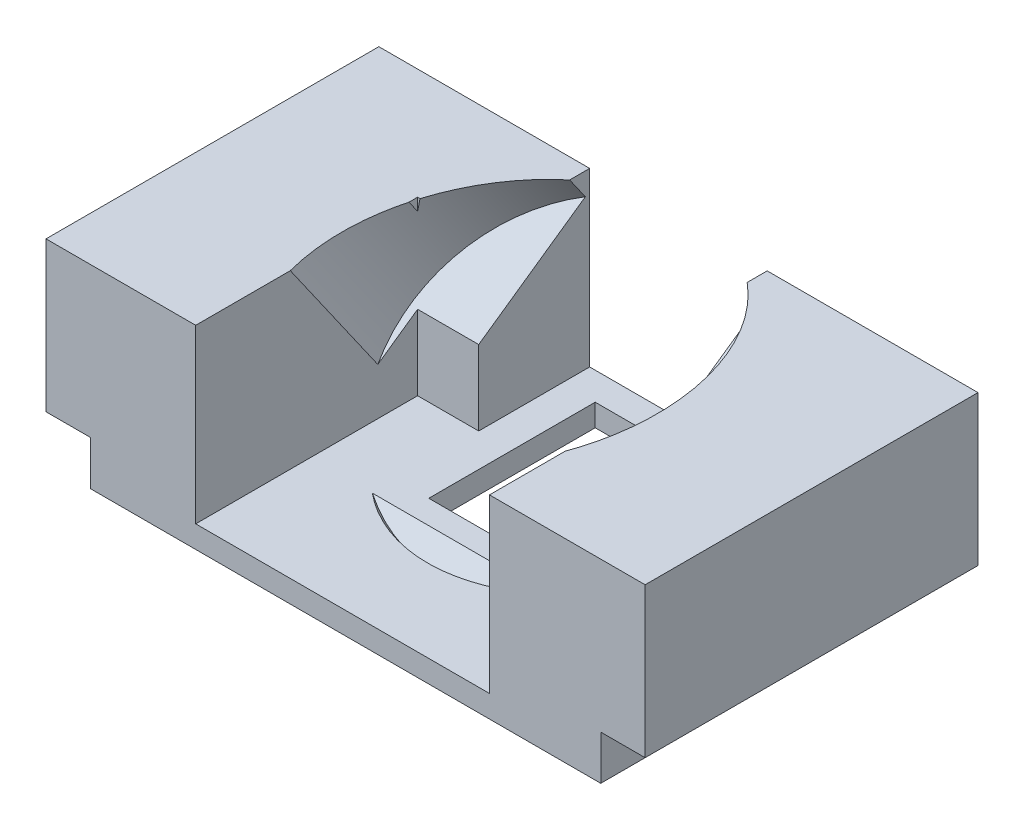
from build123d import *

# Parameters (mm, degrees)
SKETCH1_W               = 50.8
SKETCH1_H               = 22.225
BOSS_EXTRUDE1_DEPTH     = 34.29
SKETCH2_R               = 18.034
CUT_EXTRUDE1_DEPTH      = 45.095938092
SKETCH3_W               = 20.32
SKETCH3_H               = 19.685
CUT_EXTRUDE2_DEPTH      = 63.289098213
SKETCH4_W               = 12.7
SKETCH4_H               = 19.05
CUT_EXTRUDE3_DEPTH      = 45.095938092
SKETCH7_W               = 68.58
SKETCH7_H               = 12.7
CUT_EXTRUDE5_DEPTH      = 49.113560718
CUT_EXTRUDE6_DEPTH      = 45.095938092
CUT_EXTRUDE6_DEPTH_BACK = 45.095938092
SKETCH9_W               = 5.08
SKETCH9_H               = 5.08
SKETCH6_W               = 33.625329213
SKETCH6_H               = 19.685
CUT_EXTRUDE4_DEPTH      = 45.095938092


with BuildPart() as part:
    # Sketch1 → Boss-Extrude1 (new, symmetric)
    with BuildSketch(Plane(origin=(0, 0, 0), x_dir=(0, 0, -1), z_dir=(1, 0, 0))):
        Rectangle(SKETCH1_W, SKETCH1_H)
    extrude(amount=BOSS_EXTRUDE1_DEPTH, both=True)

    # Sketch2 → Cut-Extrude1 (cut, through all)
    with BuildSketch(Plane(origin=(0, 0, 0), x_dir=(1, 0, 0), z_dir=(0, 0.819152044288991, 0.5735764363510473))):
        Circle(SKETCH2_R)
    extrude(amount=CUT_EXTRUDE1_DEPTH, mode=Mode.SUBTRACT)

    # Sketch3 → Cut-Extrude2 (cut, through all)
    with BuildSketch(Plane.XY.offset(25.4)):
        with Locations((0, 1.27)):
            Rectangle(SKETCH3_W, SKETCH3_H)
    extrude(amount=-CUT_EXTRUDE2_DEPTH, mode=Mode.SUBTRACT)

    # Sketch4 → Cut-Extrude3 (cut, through all)
    with BuildSketch(Plane(origin=(0, 0, 0), x_dir=(1, 0, 0), z_dir=(0, 1, 0))):
        Rectangle(SKETCH4_W, SKETCH4_H)
    extrude(amount=-CUT_EXTRUDE3_DEPTH, mode=Mode.SUBTRACT)

    # Sketch7 → Cut-Extrude5 (cut, through all)
    with BuildSketch(Plane(origin=(0, 11.1125, 0), x_dir=(1, 0, 0), z_dir=(0, 1, 0))):
        with Locations((0, 19.05)):
            Rectangle(SKETCH7_W, SKETCH7_H)
    extrude(amount=-CUT_EXTRUDE5_DEPTH, mode=Mode.SUBTRACT)

    # Sketch9 → Cut-Extrude6 (cut, two sides: drawn at the far end of the back side and taken through both)
    with BuildSketch(Plane.XY.offset(-CUT_EXTRUDE6_DEPTH_BACK)):
        with Locations((-31.75, -8.5725)):
            Rectangle(SKETCH9_W, SKETCH9_H)
        with Locations((31.75, -8.5725)):
            Rectangle(SKETCH9_W, SKETCH9_H)
    extrude(amount=CUT_EXTRUDE6_DEPTH + CUT_EXTRUDE6_DEPTH_BACK, mode=Mode.SUBTRACT)

    # Sketch6 → Cut-Extrude4 (cut, through all)
    with BuildSketch(Plane.XY):
        with Locations((-0.341373901, 1.27)):
            Rectangle(SKETCH6_W, SKETCH6_H)
    extrude(amount=CUT_EXTRUDE4_DEPTH, mode=Mode.SUBTRACT)


solid = part.part
